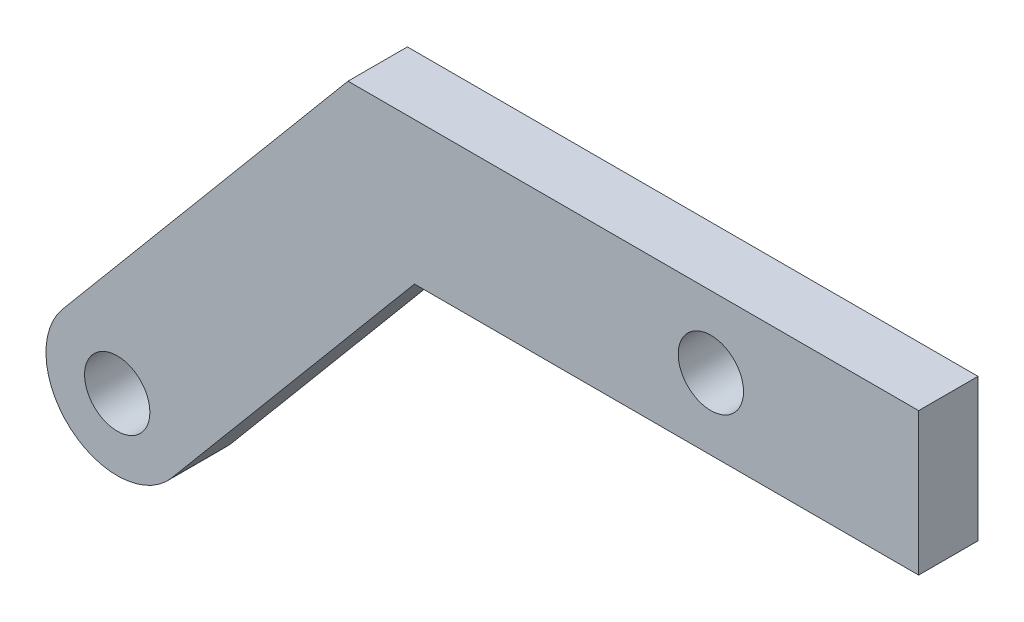
from build123d import *

# Parameters (mm, degrees)
SKETCH1_R           = 5.5
BOSS_EXTRUDE1_DEPTH = 10


with BuildPart() as part:
    # Sketch1 → Boss-Extrude1 (new body)
    with BuildSketch(Plane.XY):
        with BuildLine():
            ThreePointArc((-9.192533317, 7.713451316), (-7.713451316, -9.192533317), (9.192533317, -7.713451316))
            Line((9.192533317, -7.713451316), (50.06797235, 41))
            Line((50.06797235, 41), (135, 41))
            Line((135, 41), (135, 65))
            Line((135, 65), (38.876588555, 65))
            Line((38.876588555, 65), (-9.192533317, 7.713451316))
        make_face()
        Circle(SKETCH1_R, mode=Mode.SUBTRACT)
        with Locations((100, 53)):
            Circle(SKETCH1_R, mode=Mode.SUBTRACT)
    extrude(amount=BOSS_EXTRUDE1_DEPTH)


solid = part.part
